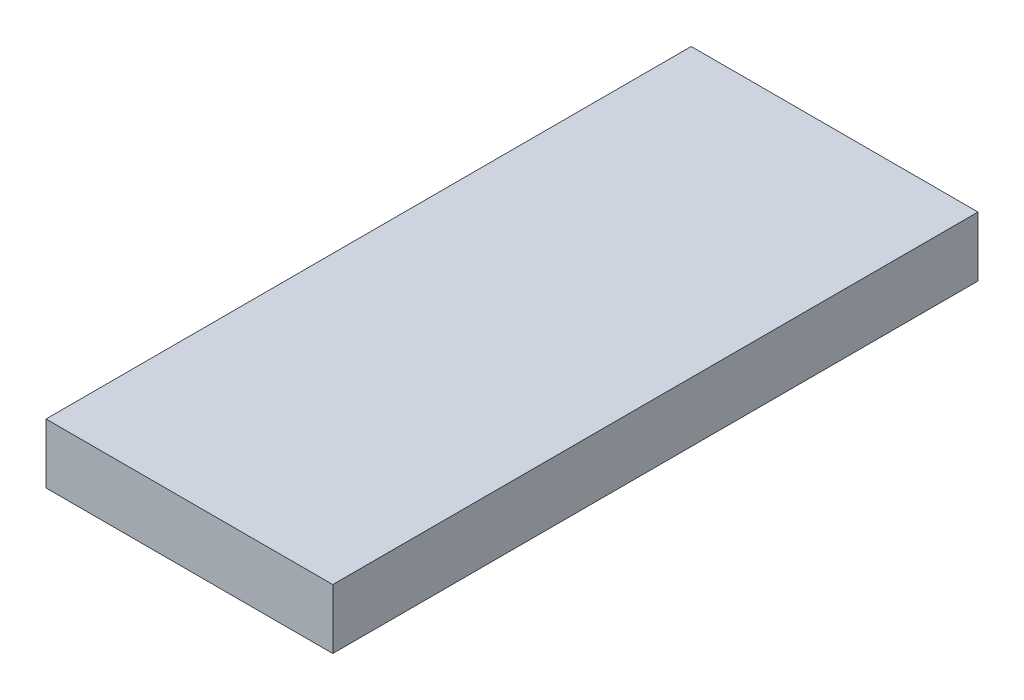
from build123d import *

# Parameters (mm, degrees)
CROQUIS1_W              = 24
CROQUIS1_H              = 54
SALIENTE_EXTRUIR1_DEPTH = 5


with BuildPart() as part:
    # Croquis1 → Saliente-Extruir1 (new body)
    with BuildSketch(Plane(origin=(0, 0, 0), x_dir=(1, 0, 0), z_dir=(0, 1, 0))):
        Rectangle(CROQUIS1_W, CROQUIS1_H)
    extrude(amount=SALIENTE_EXTRUIR1_DEPTH)


solid = part.part
